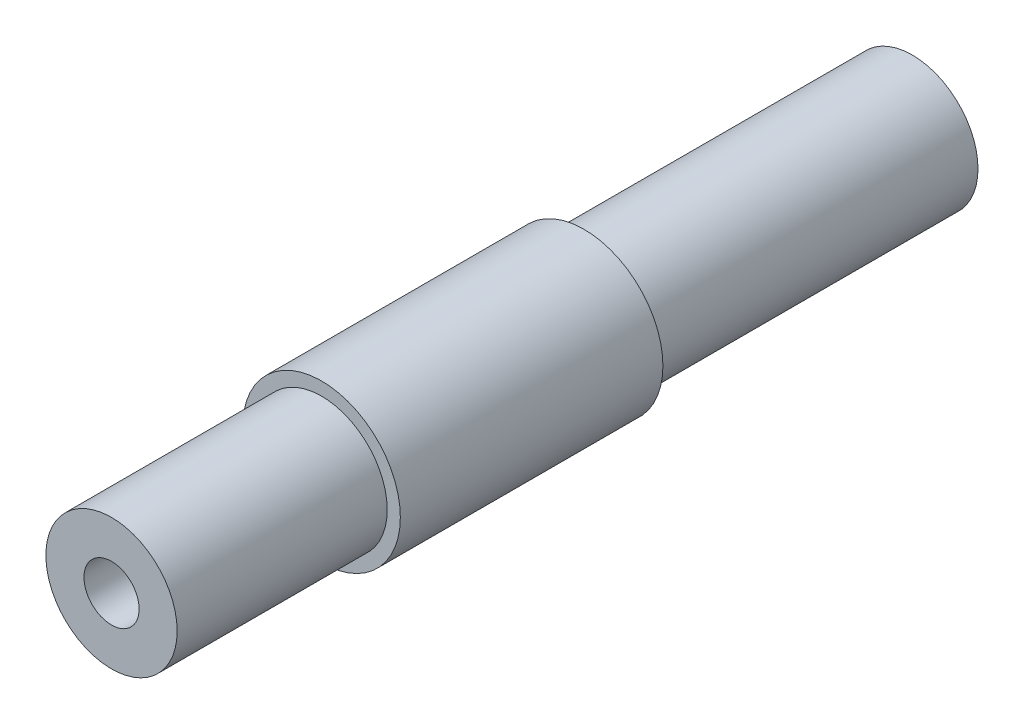
from build123d import *

# Parameters (mm, degrees)
SKETCH_1_R             = 6
EXTRUDE_1_DEPTH        = 20
SKETCH_2_R             = 5
EXTRUDE_2_DEPTH        = 16
EXTRUDE_START          = 25
SKETCH_3_R             = 5
EXTRUDE_3_DEPTH        = 25
HOLE_WIZARD_M5_1_D     = 4.2
HOLE_WIZARD_M5_1_DEPTH = 12.4
HOLE_WIZARD_M5_1_TIP   = 1.2618073
HOLE_WIZARD_M5_2_D     = 4.2
HOLE_WIZARD_M5_2_DEPTH = 12.4
HOLE_WIZARD_M5_2_TIP   = 1.2618073


with BuildPart() as part:
    # 草图1 → 凸台-拉伸1 (new body)
    with BuildSketch(Plane.XY):
        Circle(SKETCH_1_R)
    extrude(amount=EXTRUDE_1_DEPTH)

    # 草图2 → 凸台-拉伸2 (add)
    with BuildSketch(Plane.XY.offset(20)):
        Circle(SKETCH_2_R)
    extrude(amount=EXTRUDE_2_DEPTH)

    # 草图3 → 凸台-拉伸3 (add)
    with BuildSketch(Plane(origin=(0, 0, 0), x_dir=(-1, 0, 0), z_dir=(0, 0, -1)).offset(EXTRUDE_START)):
        with Locations(Location((0, 0, 0), (0, 0, 180))):
            Circle(SKETCH_3_R)
    extrude(amount=-EXTRUDE_3_DEPTH)

    # M5 螺纹孔1
    with Locations(Plane(origin=(0, 0, -25), x_dir=(-1, 0, 0), z_dir=(0, 0, -1))):
        with Locations((0, 0)):
            Hole(HOLE_WIZARD_M5_1_D / 2, depth=HOLE_WIZARD_M5_1_DEPTH)
            with Locations((0, 0, -(HOLE_WIZARD_M5_1_DEPTH + HOLE_WIZARD_M5_1_TIP / 2))):  # 118° drill point
                Cone(0, HOLE_WIZARD_M5_1_D / 2, HOLE_WIZARD_M5_1_TIP, mode=Mode.SUBTRACT)

    # M5 螺纹孔2
    with Locations(Plane.XY.offset(36)):
        with Locations((0, 0)):
            Hole(HOLE_WIZARD_M5_2_D / 2, depth=HOLE_WIZARD_M5_2_DEPTH)
            with Locations((0, 0, -(HOLE_WIZARD_M5_2_DEPTH + HOLE_WIZARD_M5_2_TIP / 2))):  # 118° drill point
                Cone(0, HOLE_WIZARD_M5_2_D / 2, HOLE_WIZARD_M5_2_TIP, mode=Mode.SUBTRACT)


solid = part.part
